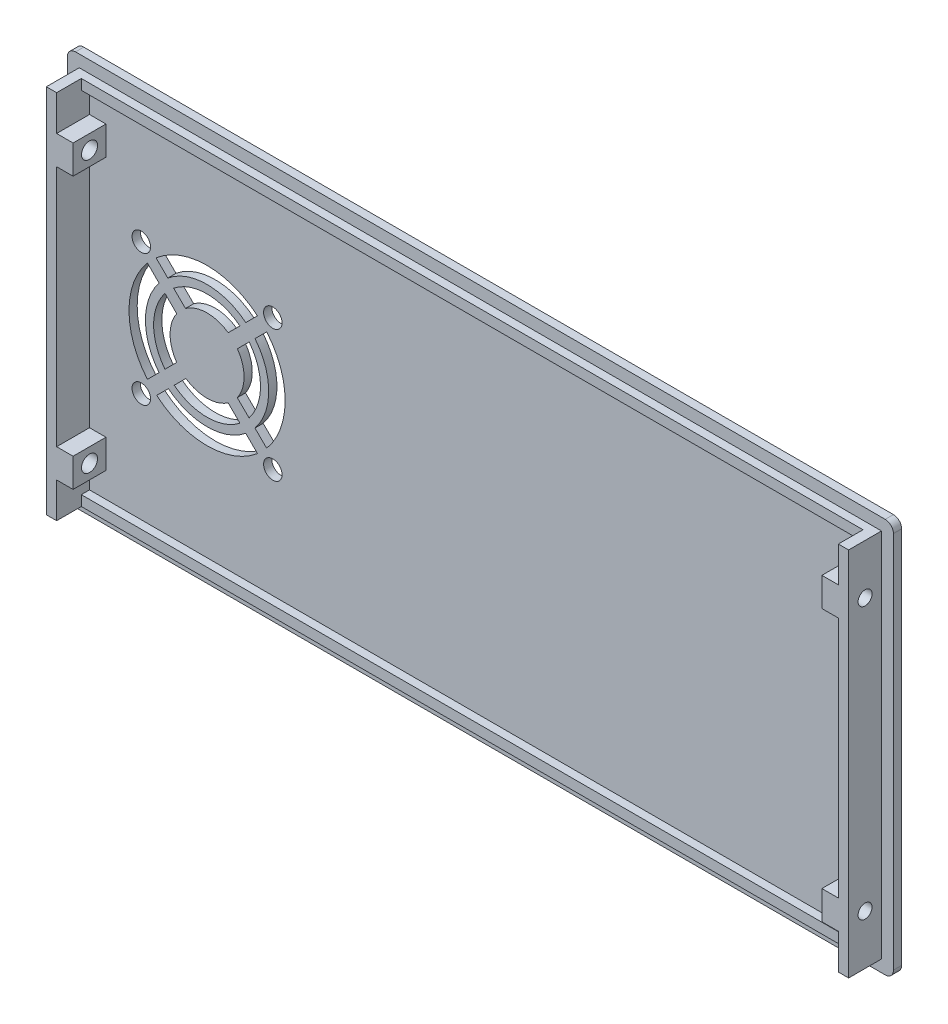
from build123d import *

# Parameters (mm, degrees)
P_DORYS_W                                         = 201
P_DORYS_H                                         = 96
P_IDAT_VYSUNUT_M1_DEPTH                           = 2
ZAOBLIT1_R                                        = 2
SKICA2_W                                          = 195.2
SKICA2_H                                          = 90.2
SKICA2_W_2                                        = 190.2
SKICA2_H_2                                        = 85.2
SKICA2_W_3                                        = 4
SKICA2_H_3                                        = 7
P_IDAT_VYSUNUT_M2_DEPTH                           = 2
P_IDAT_VYSUNUT_M3_DEPTH                           = 6
V_LCOV_ZAHLOUBEN_PRO_M6_ROUBY_S_V_LCO_D           = 3.4
V_LCOV_ZAHLOUBEN_PRO_M6_ROUBY_S_V_LCO_DEPTH       = 9.4
V_LCOV_ZAHLOUBEN_PRO_M6_ROUBY_S_V_LCO_CBORE_D     = 3.9
V_LCOV_ZAHLOUBEN_PRO_M6_ROUBY_S_V_LCO_CBORE_DEPTH = 4
SKICA7_R                                          = 2.25
ODEBRAT_VYSUNUT_M1_DEPTH                          = 6


with BuildPart() as part:
    # půdorys → Přidat vysunutím1 (new body)
    with BuildSketch(Plane.XY):
        Rectangle(P_DORYS_W, P_DORYS_H)
    extrude(amount=P_IDAT_VYSUNUT_M1_DEPTH)

    # Zaoblit1
    zaoblit1_edges = [part.edges().sort_by_distance(p)[0] for p in [
        (100.5, -48, 1),
        (-100.5, -48, 1),
        (-100.5, 48, 1),
        (100.5, 48, 1),
    ]]
    fillet(zaoblit1_edges, radius=ZAOBLIT1_R)

    # Skica2 → Přidat vysunutím2 (add)
    # profile 1 of 5: a face of its own
    with BuildSketch(Plane.XY.offset(2)):
        Rectangle(SKICA2_W, SKICA2_H)
        Rectangle(SKICA2_W_2, SKICA2_H_2, mode=Mode.SUBTRACT)
    # profile 2 of 5: a face of its own
    with BuildSketch(Plane.XY.offset(2)):
        with Locations((93.1, -33)):
            Rectangle(SKICA2_W_3, SKICA2_H_3)
    # profile 3 of 5: a face of its own
    with BuildSketch(Plane.XY.offset(2)):
        with Locations((93.1, 33)):
            Rectangle(SKICA2_W_3, SKICA2_H_3)
    # profile 4 of 5: a face of its own
    with BuildSketch(Plane.XY.offset(2)):
        with Locations((-93.1, 33)):
            Rectangle(SKICA2_W_3, SKICA2_H_3)
    # profile 5 of 5: a face of its own
    with BuildSketch(Plane.XY.offset(2)):
        with Locations((-93.1, -33)):
            Rectangle(SKICA2_W_3, SKICA2_H_3)
    extrude(amount=P_IDAT_VYSUNUT_M2_DEPTH)

    # Skica3 → Přidat vysunutím3 (add)
    with BuildSketch(Plane.XY.offset(4)):
        Polygon((95.1, 45.1), (95.1, 36.5), (91.1, 36.5), (91.1, 29.5), (95.1, 29.5), (95.1, -29.5), (91.1, -29.5), (91.1, -36.5), (95.1, -36.5), (95.1, -45.1), (97.6, -45.1), (97.6, 45.1), align=None)
        Polygon((-95.1, -45.1), (-95.1, -36.5), (-91.1, -36.5), (-91.1, -29.5), (-95.1, -29.5), (-95.1, 29.5), (-91.1, 29.5), (-91.1, 36.5), (-95.1, 36.5), (-95.1, 45.1), (-97.6, 45.1), (-97.6, -45.1), align=None)
    extrude(amount=P_IDAT_VYSUNUT_M3_DEPTH)

    # Válcové zahloubení pro M6 šrouby s válcovou hlavou zaoblenou1
    with Locations(Plane(origin=(-91.1, 33, 6), x_dir=(0, 0, 1), z_dir=(1, 0, 0))):
        with Locations((0, 0), (0, 66)):
            v_lcov_zahlouben_pro_m6_rouby_s_v_lco = CounterBoreHole(V_LCOV_ZAHLOUBEN_PRO_M6_ROUBY_S_V_LCO_D / 2, V_LCOV_ZAHLOUBEN_PRO_M6_ROUBY_S_V_LCO_CBORE_D / 2, V_LCOV_ZAHLOUBEN_PRO_M6_ROUBY_S_V_LCO_CBORE_DEPTH, depth=V_LCOV_ZAHLOUBEN_PRO_M6_ROUBY_S_V_LCO_DEPTH)

    # Zrcadlit1: Válcové zahloubení pro M6 šrouby s válcovou hlavou zaoblenou1 across plane
    add(v_lcov_zahlouben_pro_m6_rouby_s_v_lco.mirror(Plane(origin=(0, 0, 0), x_dir=(0, 0, 1), z_dir=(1, 0, 0))), mode=Mode.SUBTRACT)

    # Skica7 → Odebrat vysunutím1 (cut)
    with BuildSketch(Plane(origin=(0, 0, 0), x_dir=(-1, 0, 0), z_dir=(0, 0, -1))):
        with BuildLine():
            Line((82.5, 10.246950766), (82.5, 0))
            Line((82.5, 0), (85.5, 0))
            ThreePointArc((85.5, 0), (84.734582529, 5.338539126), (82.5, 10.246950766))
        make_face()
        with BuildLine():
            Line((85.5, 0), (82.5, 0))
            Line((82.5, 0), (82.5, -10.246950766))
            ThreePointArc((82.5, -10.246950766), (84.734582529, -5.338539126), (85.5, 0))
        make_face()
        with BuildLine():
            ThreePointArc((78.171770833, 9.421770833), (80.643489005, 4.996170409), (81.5, 0))
            Line((81.5, 0), (82.5, 0))
            Line((82.5, 0), (82.5, 10.246950766))
            ThreePointArc((82.5, 10.246950766), (81.789681929, 11.279433784), (81.0128443, 12.2628443))
            Line((81.0128443, 12.2628443), (78.171770833, 9.421770833))
        make_face()
        with BuildLine():
            ThreePointArc((57.078229167, 11.671770833), (66.586420622, 14.999751047), (76.055634012, 11.562433076))
            Line((76.055634012, 11.562433076), (78.908692733, 14.38834058))
            ThreePointArc((78.908692733, 14.38834058), (77.856447821, 15.232566852), (76.746950766, 16))
            Line((76.746950766, 16), (56.253049234, 16))
            ThreePointArc((56.253049234, 16), (55.220566216, 15.289681929), (54.2371557, 14.5128443))
            Line((54.2371557, 14.5128443), (57.078229167, 11.671770833))
        make_face()
        with BuildLine():
            Line((56.253049234, 16), (76.746950766, 16))
            ThreePointArc((76.746950766, 16), (66.5, 19), (56.253049234, 16))
        make_face()
        with BuildLine():
            ThreePointArc((51.5, 0), (52.356510995, 4.996170409), (54.828229167, 9.421770833))
            Line((54.828229167, 9.421770833), (51.9871557, 12.2628443))
            ThreePointArc((51.9871557, 12.2628443), (51.210318071, 11.279433784), (50.5, 10.246950766))
            Line((50.5, 10.246950766), (50.5, 0))
            Line((50.5, 0), (51.5, 0))
        make_face()
        with BuildLine():
            Line((50.5, 0), (50.5, 10.246950766))
            ThreePointArc((50.5, 10.246950766), (48.265417471, 5.338539126), (47.5, 0))
            Line((47.5, 0), (50.5, 0))
        make_face()
        with BuildLine():
            Line((50.5, -10.246950766), (50.5, 0))
            Line((50.5, 0), (47.5, 0))
            ThreePointArc((47.5, 0), (48.265417471, -5.338539126), (50.5, -10.246950766))
        make_face()
        with BuildLine():
            Line((51.993667632, -12.2705469), (54.846726353, -9.444639395))
            ThreePointArc((54.846726353, -9.444639395), (52.361416183, -5.010034695), (51.5, 0))
            Line((51.5, 0), (50.5, 0))
            Line((50.5, 0), (50.5, -10.246950766))
            ThreePointArc((50.5, -10.246950766), (51.213312525, -11.283491748), (51.993667632, -12.2705469))
        make_face()
        with BuildLine():
            Line((78.7628443, -14.5128443), (75.921770833, -11.671770833))
            ThreePointArc((75.921770833, -11.671770833), (66.5, -15), (57.078229167, -11.671770833))
            Line((57.078229167, -11.671770833), (54.2371557, -14.5128443))
            ThreePointArc((54.2371557, -14.5128443), (55.220566216, -15.289681929), (56.253049234, -16))
            Line((56.253049234, -16), (76.746950766, -16))
            ThreePointArc((76.746950766, -16), (77.779433784, -15.289681929), (78.7628443, -14.5128443))
        make_face()
        with BuildLine():
            ThreePointArc((56.253049234, -16), (66.5, -19), (76.746950766, -16))
            Line((76.746950766, -16), (56.253049234, -16))
        make_face()
        with BuildLine():
            Line((82.5, 0), (81.5, 0))
            ThreePointArc((81.5, 0), (80.643489005, -4.996170409), (78.171770833, -9.421770833))
            Line((78.171770833, -9.421770833), (81.0128443, -12.2628443))
            ThreePointArc((81.0128443, -12.2628443), (81.789681929, -11.279433784), (82.5, -10.246950766))
            Line((82.5, -10.246950766), (82.5, 0))
        make_face()
        with BuildLine():
            ThreePointArc((76.748287511, -7.998287511), (78.792838111, -4.229199828), (79.5, 0))
            Line((79.5, 0), (75.5, 0))
            ThreePointArc((75.5, 0), (75.087741676, -2.692711071), (73.888734908, -5.138734908))
            Line((73.888734908, -5.138734908), (76.748287511, -7.998287511))
        make_face()
        with BuildLine():
            ThreePointArc((58.501712489, -10.248287511), (66.5, -13), (74.498287511, -10.248287511))
            Line((74.498287511, -10.248287511), (71.638734908, -7.388734908))
            ThreePointArc((71.638734908, -7.388734908), (66.5, -9), (61.361265092, -7.388734908))
            Line((61.361265092, -7.388734908), (58.501712489, -10.248287511))
        make_face()
        with BuildLine():
            ThreePointArc((53.5, 0), (54.213544679, -4.247707105), (56.275848561, -8.02911747))
            Line((56.275848561, -8.02911747), (59.145152054, -5.187119788))
            ThreePointArc((59.145152054, -5.187119788), (57.921141349, -2.720879314), (57.5, 0))
            Line((57.5, 0), (53.5, 0))
        make_face()
        with BuildLine():
            Line((59.111265092, 5.138734908), (56.251712489, 7.998287511))
            ThreePointArc((56.251712489, 7.998287511), (54.207161889, 4.229199828), (53.5, 0))
            Line((53.5, 0), (57.5, 0))
            ThreePointArc((57.5, 0), (57.912258324, 2.692711071), (59.111265092, 5.138734908))
        make_face()
        with BuildLine():
            Line((71.757208311, 7.304913468), (74.626511804, 10.146911151))
            ThreePointArc((74.626511804, 10.146911151), (66.581729181, 12.999743088), (58.501712489, 10.248287511))
            Line((58.501712489, 10.248287511), (61.361265092, 7.388734908))
            ThreePointArc((61.361265092, 7.388734908), (66.572563732, 8.999707468), (71.757208311, 7.304913468))
        make_face()
        with BuildLine():
            Line((75.5, 0), (79.5, 0))
            ThreePointArc((79.5, 0), (78.792838111, 4.229199828), (76.748287511, 7.998287511))
            Line((76.748287511, 7.998287511), (73.888734908, 5.138734908))
            ThreePointArc((73.888734908, 5.138734908), (75.087741676, 2.692711071), (75.5, 0))
        make_face()
        with Locations((50.5, -16)):
            Circle(SKICA7_R)
        with Locations((82.5, -16)):
            Circle(SKICA7_R)
        with Locations((82.5, 16)):
            Circle(SKICA7_R)
        with Locations((50.5, 16)):
            Circle(SKICA7_R)
    extrude(amount=-ODEBRAT_VYSUNUT_M1_DEPTH, mode=Mode.SUBTRACT)


solid = part.part
